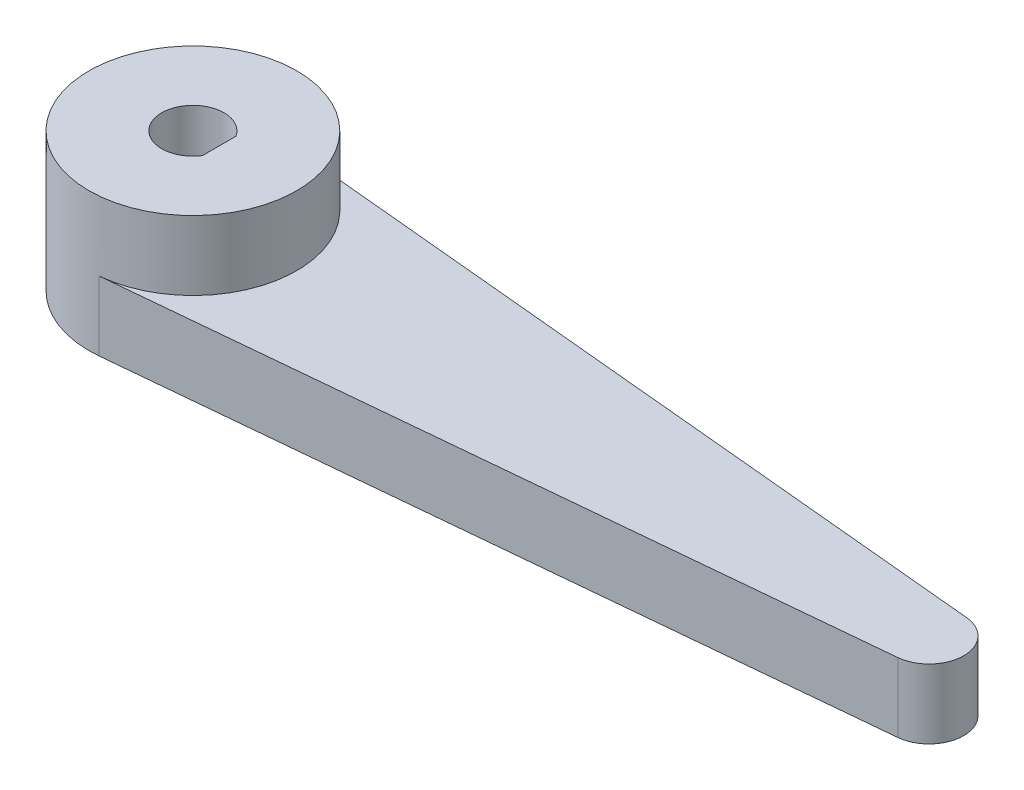
from build123d import *
from build123d.topology import SkipClean

# Parameters (mm, degrees)
EXTRUDE_1_DEPTH     = 5
SKETCH_2_R          = 7.5
EXTRUDE_2_DEPTH     = 5
CUT_EXTRUDE_1_DEPTH = 58.031822398


with BuildPart() as part:
    # 草图1 → 凸台-拉伸1 (new body)
    with BuildSketch(Plane(origin=(0, 0, 0), x_dir=(1, 0, 0), z_dir=(0, 1, 0))):
        with BuildLine():
            Line((0.705615189, 7.466733369), (53.380319548, 2.488911123))
            ThreePointArc((53.380319548, 2.488911123), (55.645114485, 0), (53.380319548, -2.488911123))
            Line((53.380319548, -2.488911123), (0.705615189, -7.466733369))
            ThreePointArc((0.705615189, -7.466733369), (-7.5, 0), (0.705615189, 7.466733369))
        make_face()
    extrude(amount=EXTRUDE_1_DEPTH)

    # 草图2 → 凸台-拉伸2 (add)
    with SkipClean():  # the faces are left unmerged after this step: merging them gives an invalid solid
        with BuildSketch(Plane(origin=(0, 5, 0), x_dir=(1, 0, 0), z_dir=(0, 1, 0))):
            with Locations(Location((0, 0, 0), (0, 0, 84.601512911))):
                Circle(SKETCH_2_R)
        extrude(amount=EXTRUDE_2_DEPTH)

    # 草图3 → 切除-拉伸1 (cut, through all)
    with SkipClean():  # the faces are left unmerged after this step: merging them gives an invalid solid
        with BuildSketch(Plane(origin=(0, 10, 0), x_dir=(1, 0, 0), z_dir=(0, 1, 0))):
            with BuildLine():
                Line((1.897388784, 1.20930385), (1.897388784, -1.20930385))
                ThreePointArc((1.897388784, -1.20930385), (-2.25, 0), (1.897388784, 1.20930385))
            make_face()
        extrude(amount=-CUT_EXTRUDE_1_DEPTH, mode=Mode.SUBTRACT)


solid = part.part
